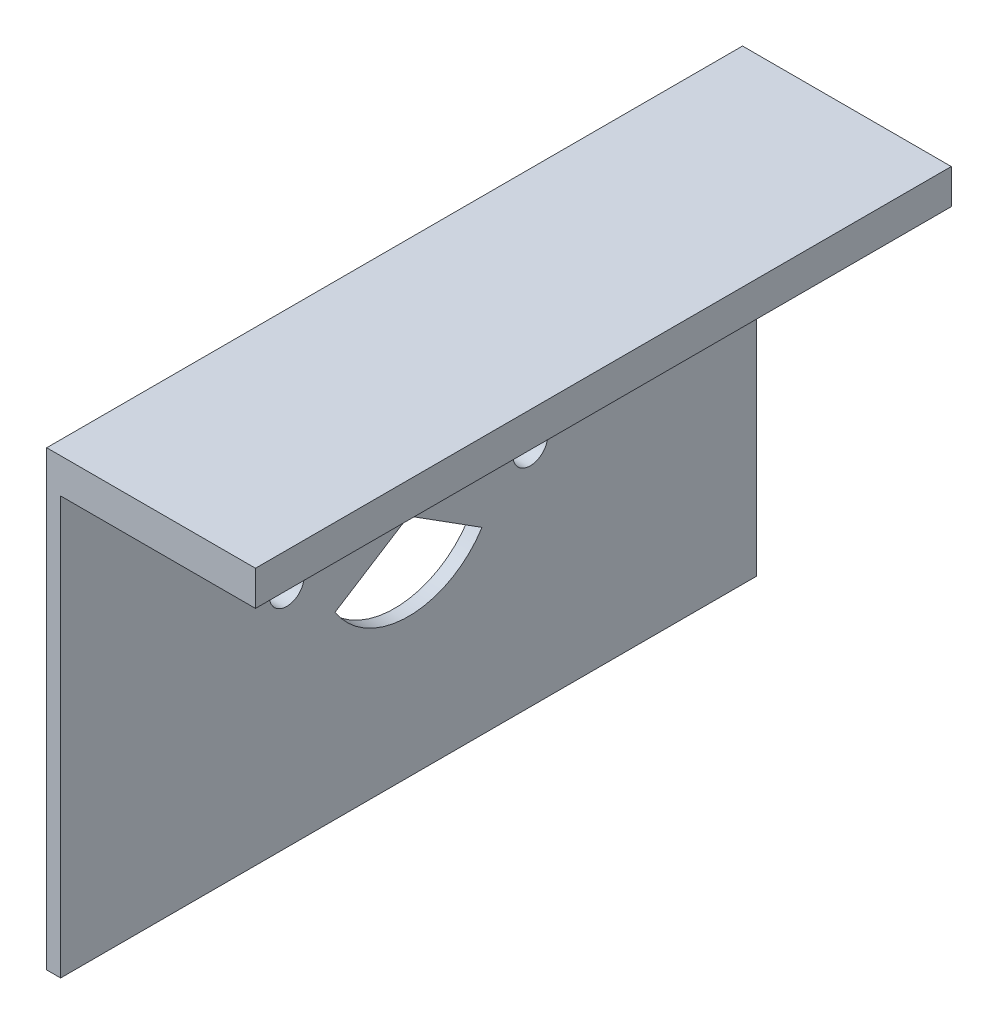
from build123d import *

# Parameters (mm, degrees)
SKETCH1_W           = 100
SKETCH1_H           = 5
BOSS_EXTRUDE5_DEPTH = 2
SKETCH4_W           = 100
SKETCH4_H           = 5
BOSS_EXTRUDE6_DEPTH = 28


with BuildPart() as part:
    # Sketch1 → Boss-Extrude5 (new body)
    with BuildSketch(Plane(origin=(0, 0, 0), x_dir=(0, 0, -1), z_dir=(1, 0, 0))):
        with Locations((0, 30)):
            Rectangle(SKETCH1_W, SKETCH1_H)
        with BuildLine():
            ThreePointArc((-12.5, 0), (0, 12.5), (12.5, 0))
            Line((12.5, 0), (15, 0))
            ThreePointArc((15, 0), (17.5, 2.5), (20, 0))
            Line((20, 0), (50, 0))
            Line((50, 0), (50, 27.5))
            Line((50, 27.5), (-50, 27.5))
            Line((-50, 27.5), (-50, 0))
            Line((-50, 0), (-20, 0))
            ThreePointArc((-20, 0), (-17.5, 2.5), (-15, 0))
            Line((-15, 0), (-12.5, 0))
        make_face()
        with BuildLine():
            Line((-12.5, 0), (0, 0))
            Line((0, 0), (12.5, 0))
            ThreePointArc((12.5, 0), (0, 12.5), (-12.5, 0))
        make_face()
        with BuildLine():
            Line((-10.55739691, -6.692635541), (0, 0))
            Line((0, 0), (-12.5, 0))
            ThreePointArc((-12.5, 0), (-12.00452959, -3.484432423), (-10.55739691, -6.692635541))
        make_face()
        with BuildLine():
            Line((12.5, 0), (0, 0))
            Line((0, 0), (10.55739691, -6.692635541))
            ThreePointArc((10.55739691, -6.692635541), (12.00452959, -3.484432423), (12.5, 0))
        make_face()
        with BuildLine():
            ThreePointArc((10.55739691, -6.692635541), (0, -12.5), (-10.55739691, -6.692635541))
            ThreePointArc((-10.55739691, -6.692635541), (-12.00452959, -3.484432423), (-12.5, 0))
            Line((-12.5, 0), (-15, 0))
            ThreePointArc((-15, 0), (-17.5, -2.5), (-20, 0))
            Line((-20, 0), (-50, 0))
            Line((-50, 0), (-50, -32.5))
            Line((-50, -32.5), (50, -32.5))
            Line((50, -32.5), (50, 0))
            Line((50, 0), (20, 0))
            ThreePointArc((20, 0), (17.5, -2.5), (15, 0))
            Line((15, 0), (12.5, 0))
            ThreePointArc((12.5, 0), (12.00452959, -3.484432423), (10.55739691, -6.692635541))
        make_face()
    extrude(amount=BOSS_EXTRUDE5_DEPTH)

    # Sketch4 → Boss-Extrude6 (add)
    with BuildSketch(Plane(origin=(2, 0, 0), x_dir=(0, 0, -1), z_dir=(1, 0, 0))):
        with Locations((0, 30)):
            Rectangle(SKETCH4_W, SKETCH4_H)
    extrude(amount=BOSS_EXTRUDE6_DEPTH)


solid = part.part
